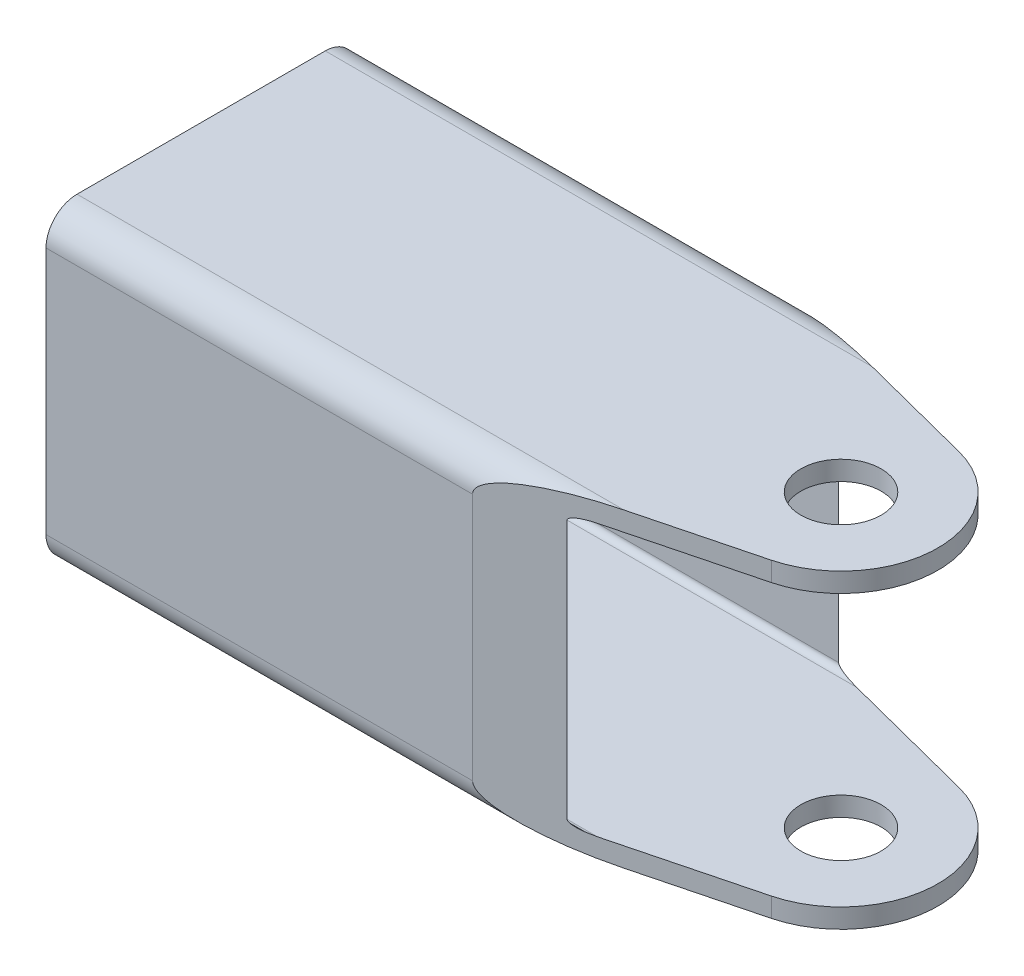
from build123d import *

# Parameters (mm, degrees)
BOSS_EXTRUDE1_DEPTH      = 25.4
BOSS_EXTRUDE1_DEPTH_BACK = 34.925
CUT_EXTRUDE4_DEPTH       = 63.941922635
CUT_EXTRUDE5_DEPTH       = 46.01339384
SKETCH14_R               = 3.2893
CUT_EXTRUDE6_DEPTH       = 46.01339384


with BuildPart() as part:
    # Sketch1 → Boss-Extrude1 (new, two sides: drawn at the far end of the back side and taken through both)
    with BuildSketch(Plane(origin=(0, 0, 0), x_dir=(0, 0, -1), z_dir=(1, 0, 0)).offset(-BOSS_EXTRUDE1_DEPTH_BACK)):
        with BuildLine():
            Line((-10.16, 12.7), (10.16, 12.7))
            ThreePointArc((10.16, 12.7), (11.956051224, 11.956051224), (12.7, 10.16))
            Line((12.7, 10.16), (12.7, -10.16))
            ThreePointArc((12.7, -10.16), (11.956051224, -11.956051224), (10.16, -12.7))
            Line((10.16, -12.7), (-10.16, -12.7))
            ThreePointArc((-10.16, -12.7), (-11.956051224, -11.956051224), (-12.7, -10.16))
            Line((-12.7, -10.16), (-12.7, 10.16))
            ThreePointArc((-12.7, 10.16), (-11.956051224, 11.956051224), (-10.16, 12.7))
        make_face()
    extrude(amount=BOSS_EXTRUDE1_DEPTH + BOSS_EXTRUDE1_DEPTH_BACK)

    # Sketch11 → Cut-Extrude4 (cut, through all)
    with BuildSketch(Plane(origin=(25.4, 0, 0), x_dir=(0, 0, -1), z_dir=(1, 0, 0))):
        with BuildLine():
            Line((-10.6045, 11.1125), (10.6045, 11.1125))
            ThreePointArc((10.6045, 11.1125), (10.963710245, 10.963710245), (11.1125, 10.6045))
            Line((11.1125, 10.6045), (11.1125, -10.6045))
            ThreePointArc((11.1125, -10.6045), (10.963710245, -10.963710245), (10.6045, -11.1125))
            Line((10.6045, -11.1125), (-10.6045, -11.1125))
            ThreePointArc((-10.6045, -11.1125), (-10.963710245, -10.963710245), (-11.1125, -10.6045))
            Line((-11.1125, -10.6045), (-11.1125, 10.6045))
            ThreePointArc((-11.1125, 10.6045), (-10.963710245, 10.963710245), (-10.6045, 11.1125))
        make_face()
    extrude(amount=-CUT_EXTRUDE4_DEPTH, mode=Mode.SUBTRACT)

    # Sketch12 → Cut-Extrude5 (cut, through all)
    with BuildSketch(Plane(origin=(0, 12.7, 0), x_dir=(1, 0, 0), z_dir=(0, 1, 0))):
        with BuildLine():
            Line((0, 12.7), (50.8, 12.7))
            Line((50.8, 12.7), (50.8, -12.7))
            Line((50.8, -12.7), (0, -12.7))
            Line((0, -12.7), (19.444424463, -7.686083637))
            ThreePointArc((19.444424463, -7.686083637), (25.4, 0), (19.444424463, 7.686083637))
            Line((19.444424463, 7.686083637), (0, 12.7))
        make_face()
    extrude(amount=-CUT_EXTRUDE5_DEPTH, mode=Mode.SUBTRACT)

    # Sketch14 → Cut-Extrude6 (cut, through all)
    with BuildSketch(Plane(origin=(0, 12.7, 0), x_dir=(1, 0, 0), z_dir=(0, 1, 0))):
        with Locations(Location((17.4625, 0, 0), (0, 0, 270))):
            Circle(SKETCH14_R)
    extrude(amount=-CUT_EXTRUDE6_DEPTH, mode=Mode.SUBTRACT)


solid = part.part
